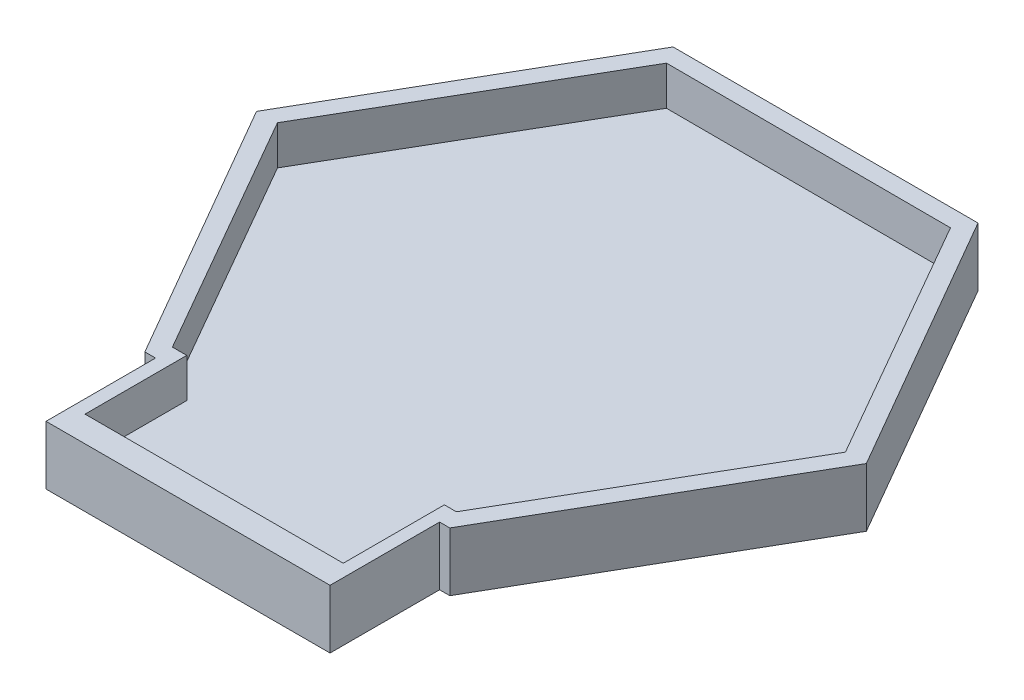
from build123d import *

# Parameters (mm, degrees)
SKETCH1_W           = 92.202
SKETCH1_H           = 35.56
BOSS_EXTRUDE3_DEPTH = 19.05
SKETCH4_W           = 83.82
SKETCH4_H           = 33.02
CUT_EXTRUDE1_DEPTH  = 12.7


with BuildPart() as part:
    # Sketch1 → Boss-Extrude3 (new body)
    with BuildSketch(Plane(origin=(0, 0, 0), x_dir=(1, 0, 0), z_dir=(0, 1, 0))):
        Polygon((-49.493351826, -85.725), (49.493351826, -85.725), (98.986703653, 0), (49.493351826, 85.725), (-49.493351826, 85.725), (-98.986703653, 0), align=None)
        with Locations((0.077086569, -103.505)):
            Rectangle(SKETCH1_W, SKETCH1_H)
    extrude(amount=BOSS_EXTRUDE3_DEPTH)

    # Sketch4 → Cut-Extrude1 (cut)
    with BuildSketch(Plane(origin=(0, 19.05, 0), x_dir=(1, 0, 0), z_dir=(0, 1, 0))):
        Polygon((46.011704472, -80.114854126), (92.387351129, -0.210122118), (46.375646657, 79.904732007), (-46.011704472, 80.114854126), (-92.387351129, 0.210122118), (-46.375646657, -79.904732007), align=None)
        with Locations((0.204587762, -96.425353803)):
            Rectangle(SKETCH4_W, SKETCH4_H)
    extrude(amount=-CUT_EXTRUDE1_DEPTH, mode=Mode.SUBTRACT)


solid = part.part
